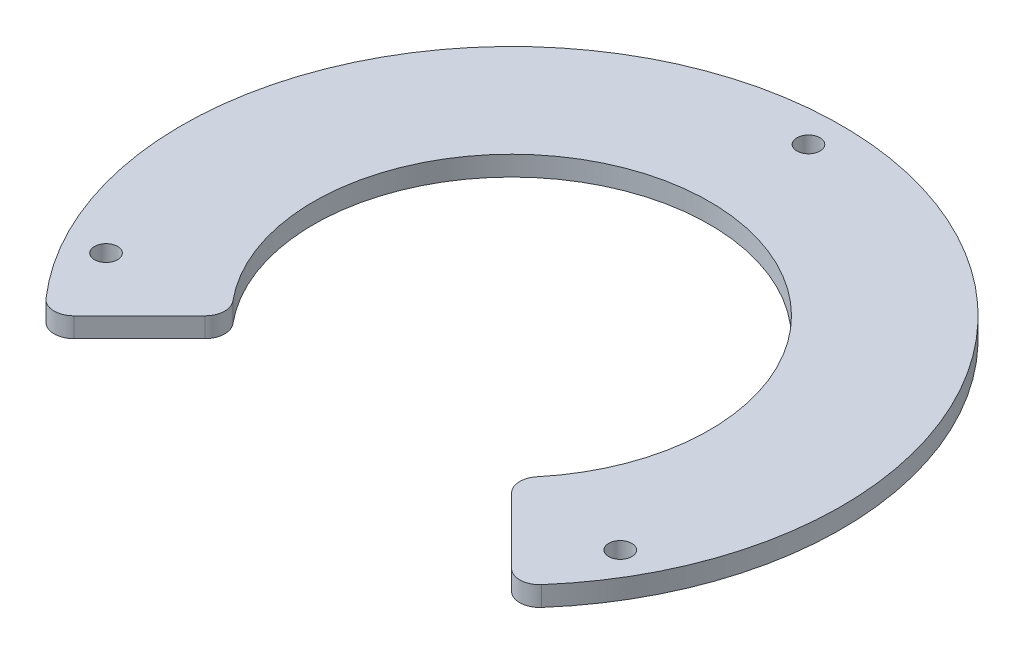
from build123d import *

# Parameters (mm, degrees)
SKETCH1_R           = 50
SKETCH1_R_2         = 30
SKETCH1_R_3         = 1.75
BOSS_EXTRUDE1_DEPTH = 3
CUT_EXTRUDE1_DEPTH  = 14
FILLET1_R           = 3


with BuildPart() as part:
    # Sketch1 → Boss-Extrude1 (new body)
    with BuildSketch(Plane(origin=(0, 0, 0), x_dir=(1, 0, 0), z_dir=(0, 1, 0))):
        with Locations(Location((0, 0, 0), (0, 0, 270))):
            Circle(SKETCH1_R)
        with Locations(Location((0, 0, 0), (0, 0, 270))):
            Circle(SKETCH1_R_2, mode=Mode.SUBTRACT)
        with Locations(Location((0, 45, 0), (0, 0, 270))):
            Circle(SKETCH1_R_3, mode=Mode.SUBTRACT)
        with Locations(Location((38.97114317, -22.5, 0), (0, 0, 270))):
            Circle(SKETCH1_R_3, mode=Mode.SUBTRACT)
        with Locations(Location((-38.97114317, -22.5, 0), (0, 0, 270))):
            Circle(SKETCH1_R_3, mode=Mode.SUBTRACT)
    extrude(amount=BOSS_EXTRUDE1_DEPTH)

    # Sketch2 → Cut-Extrude1 (cut)
    with BuildSketch(Plane(origin=(0, 3, 0), x_dir=(1, 0, 0), z_dir=(0, 1, 0))):
        Polygon((0, 0), (-50, -50), (50, -50), align=None)
    extrude(amount=-CUT_EXTRUDE1_DEPTH, mode=Mode.SUBTRACT)

    # Fillet1
    fillet1_edges = [part.edges().sort_by_distance(p)[0] for p in [
        (-21.213203436, 1.5, 21.213203436),
        (21.213203436, 1.5, 21.213203436),
        (35.355339059, 1.5, 35.355339059),
        (-35.355339059, 1.5, 35.355339059),
    ]]
    fillet(fillet1_edges, radius=FILLET1_R)


solid = part.part
